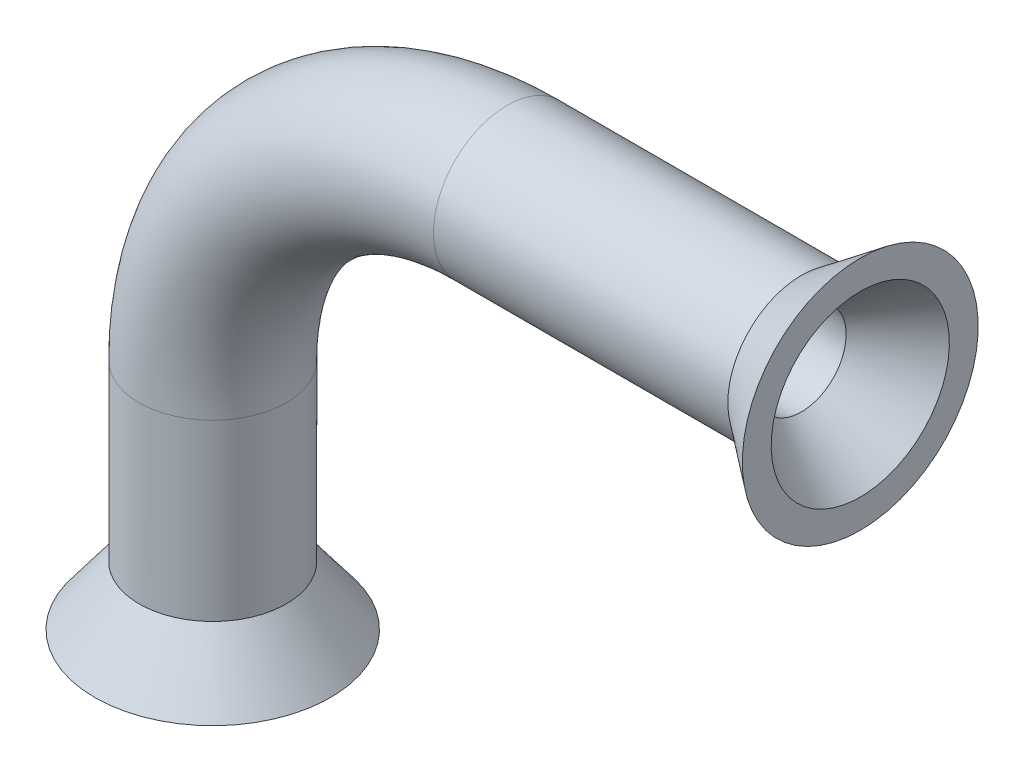
from build123d import *

# Parameters (mm, degrees)
SKETCH1_R           = 3.175
SKETCH1_R_2         = 1.9304
SKETCH3_R           = 3.175
BOSS_EXTRUDE1_DEPTH = 2.54
BOSS_EXTRUDE1_DRAFT = -37
SKETCH5_R           = 3.175
BOSS_EXTRUDE2_DEPTH = 2.54
BOSS_EXTRUDE2_DRAFT = -37


with BuildPart() as part:
    # Sweep1: sweep along a path in Sketch2
    with BuildLine(Plane.XY) as sweep1_path:
        Line((0, 0), (0, 7.5184))
        ThreePointArc((0, 7.5184), (3.719743879, 16.498656121), (12.7, 20.2184))
        Line((12.7, 20.2184), (25.4, 20.2184))
    # Sketch1 → Sweep1 (sweep)
    with BuildSketch(Plane(origin=(0, 0, 0), x_dir=(1, 0, 0), z_dir=(0, 1, 0))):
        Circle(SKETCH1_R)
        Circle(SKETCH1_R_2, mode=Mode.SUBTRACT)
    sweep(path=sweep1_path.line)


with BuildPart() as boss_extrude1_tool:
    # Sketch3 → Boss-Extrude1 (with draft: the straight prism first)
    with BuildSketch(Plane.XZ):
        with Locations(Location((0, 0, 0), (0, 0, 180))):
            Circle(SKETCH3_R)
    extrude(amount=BOSS_EXTRUDE1_DEPTH)
    # Boss-Extrude1: the draft: its side faces are tilted about the plane it starts from
    boss_extrude1_sides = [boss_extrude1_tool.faces().sort_by_distance(p)[0] for p in [
        (3.175, -1.27, 0),
    ]]
    draft(boss_extrude1_sides, Plane.XZ, BOSS_EXTRUDE1_DRAFT)


with BuildPart() as part_1:
    add(part.part)

    # Boss-Extrude1: add boss_extrude1_tool
    add(boss_extrude1_tool.part)

    # Cut-Extrude1 cone 1 section (through the dimple's axis) → Cut-Extrude1 (revolve, cut)
    with BuildSketch(Plane(origin=(0, -2.54, 0), x_dir=(0, 0, -1), z_dir=(1, 0, 0))):
        Polygon((0, 0), (3.844427287, 0), (0, 5.101727324), align=None)
    revolve(axis=Axis((0, -2.54, 0), (0, 1, 0)), mode=Mode.SUBTRACT)


with BuildPart() as boss_extrude2_tool:
    # Sketch5 → Boss-Extrude2 (with draft: the straight prism first)
    with BuildSketch(Plane(origin=(25.4, 0, 0), x_dir=(0, 0, -1), z_dir=(1, 0, 0))):
        with Locations(Location((0, 20.2184, 0), (0, 0, 90))):
            Circle(SKETCH5_R)
    extrude(amount=BOSS_EXTRUDE2_DEPTH)
    # Boss-Extrude2: the draft: its side faces are tilted about the plane it starts from
    boss_extrude2_sides = [boss_extrude2_tool.faces().sort_by_distance(p)[0] for p in [
        (26.67, 17.0434, 0),
    ]]
    draft(boss_extrude2_sides, Plane(origin=(25.4, 0, 0), x_dir=(0, 0, -1), z_dir=(1, 0, 0)), BOSS_EXTRUDE2_DRAFT)


with BuildPart() as part_2:
    add(part_1.part)

    # Boss-Extrude2: add boss_extrude2_tool
    add(boss_extrude2_tool.part)

    # Cut-Extrude2 cone 1 section (through the dimple's axis) → Cut-Extrude2 (revolve, cut)
    with BuildSketch(Plane(origin=(27.94, 20.2184, 0), x_dir=(0, 0, -1), z_dir=(0, 1, 0))):
        Polygon((0, 0), (3.844427287, 0), (0, 5.101727324), align=None)
    revolve(axis=Axis((27.94, 20.2184, 0), (-1, 0, 0)), mode=Mode.SUBTRACT)


solid = part_2.part
